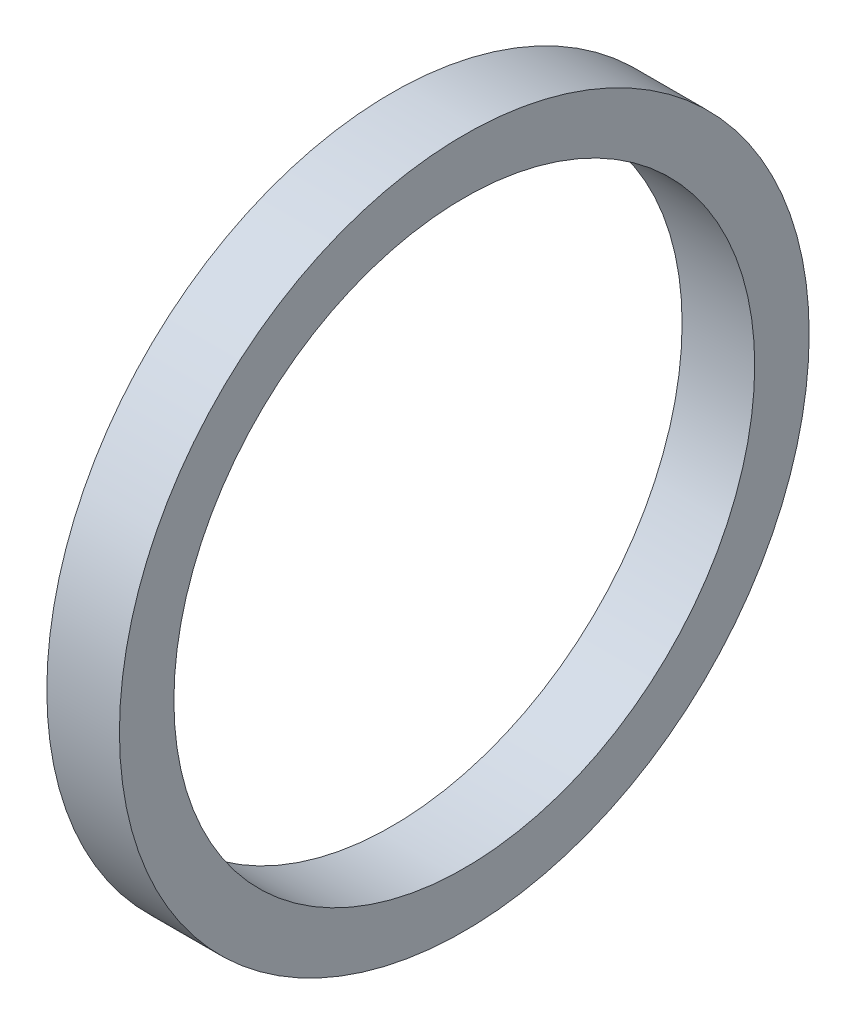
from build123d import *

# Parameters (mm, degrees)
SKETCH1_R           = 4.75
SKETCH1_R_2         = 4
BOSS_EXTRUDE1_DEPTH = 1


with BuildPart() as part:
    # Sketch1 → Boss-Extrude1 (new body)
    with BuildSketch(Plane(origin=(0, 0, 0), x_dir=(0, 0, -1), z_dir=(1, 0, 0))):
        Circle(SKETCH1_R)
        Circle(SKETCH1_R_2, mode=Mode.SUBTRACT)
    extrude(amount=BOSS_EXTRUDE1_DEPTH)


solid = part.part
